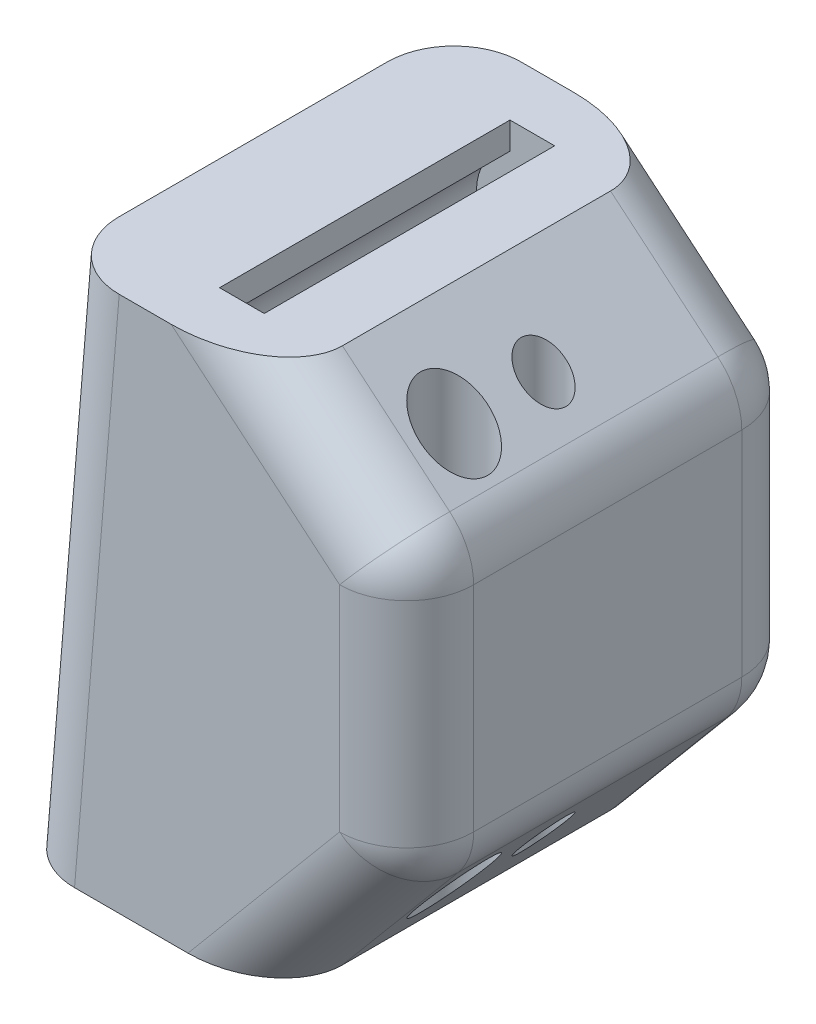
from build123d import *

# Parameters (mm, degrees)
BOSS_EXTRUDE1_DEPTH = 18
CUT_EXTRUDE1_START  = -2.5
CUT_EXTRUDE1_DEPTH  = 13
CUT_EXTRUDE2_START  = -2.5
CUT_EXTRUDE2_DEPTH  = 13
SKETCH5_R           = 1
SKETCH5_R_2         = 1.5
CUT_EXTRUDE3_DEPTH  = 25
FILLET1_R           = 3


with BuildPart() as part:
    # Sketch2 → Boss-Extrude1 (new body)
    with BuildSketch(Plane.XY):
        with BuildLine():
            Line((0, 0), (12, 0))
            Line((12, 0), (17.171830748, 6.163547874))
            ThreePointArc((17.171830748, 6.163547874), (17.692775281, 7.065850273), (17.873697418, 8.091910703))
            Line((17.873697418, 8.091910703), (17.873697418, 17.672459688))
            ThreePointArc((17.873697418, 17.672459688), (17.592620779, 18.940314473), (16.802060247, 19.970593018))
            Line((16.802060247, 19.970593018), (12, 24))
            Line((12, 24), (2, 24))
            Line((2, 24), (0, 0))
        make_face()
    extrude(amount=BOSS_EXTRUDE1_DEPTH)

    # Sketch3 → Cut-Extrude1 (cut)
    with BuildSketch(Plane.XY.offset(18).offset(CUT_EXTRUDE1_START)):
        with BuildLine():
            Line((7, 24), (9, 24))
            Line((9, 24), (9, 22.791287847))
            ThreePointArc((9, 22.791287847), (8, 18), (7, 22.791287847))
            Line((7, 22.791287847), (7, 24))
        make_face()
    extrude(amount=-CUT_EXTRUDE1_DEPTH, mode=Mode.SUBTRACT)

    # Sketch4 → Cut-Extrude2 (cut)
    with BuildSketch(Plane(origin=(0, 0, 0), x_dir=(-1, 0, 0), z_dir=(0, 0, -1)).offset(CUT_EXTRUDE2_START)):
        with BuildLine():
            Line((-9, 0), (-7, 0))
            Line((-7, 0), (-7, 1.208712153))
            ThreePointArc((-7, 1.208712153), (-8, 6), (-9, 1.208712153))
            Line((-9, 1.208712153), (-9, 0))
        make_face()
    extrude(amount=-CUT_EXTRUDE2_DEPTH, mode=Mode.SUBTRACT)

    # Sketch5 → Cut-Extrude3 (cut)
    with BuildSketch(Plane(origin=(0, 0, 0), x_dir=(1, 0, 0), z_dir=(0, 1, 0))):
        with Locations((15, -9)):
            Circle(SKETCH5_R)
        with Locations((15, -13)):
            Circle(SKETCH5_R_2)
    extrude(amount=CUT_EXTRUDE3_DEPTH, mode=Mode.SUBTRACT)

    # Fillet1
    fillet1_edges = [part.edges().sort_by_distance(p)[0] for p in [
        (17.692775281, 7.065850273, 0),
        (14.585915374, 3.081773937, 0),
        (1, 12, 0),
        (14.585915374, 3.081773937, 18),
        (17.692775281, 7.065850273, 18),
        (17.873697418, 12.882185196, 18),
        (17.592620779, 18.940314473, 18),
        (14.401030124, 21.985296509, 18),
        (1, 12, 18),
        (14.401030124, 21.985296509, 0),
        (17.592620779, 18.940314473, 0),
        (17.873697418, 12.882185196, 0),
    ]]
    fillet(fillet1_edges, radius=FILLET1_R)


solid = part.part
